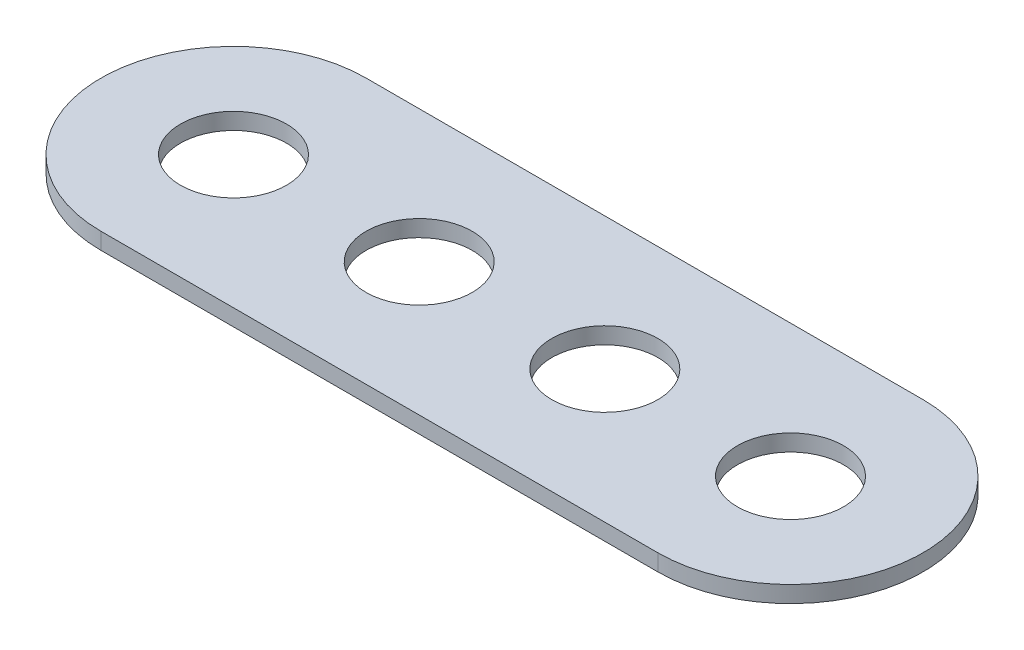
from build123d import *

# Parameters (mm, degrees)
BOSS_EXTRUDE1_DEPTH = 3.175
SKETCH3_R           = 10.16
CUT_EXTRUDE1_DEPTH  = 135.537604501
LPATTERN1_COUNT     = 4
LPATTERN1_PITCH     = 35.56


with BuildPart() as part:
    # Sketch1 → Boss-Extrude1 (new body)
    with BuildSketch(Plane(origin=(0, 0, 0), x_dir=(1, 0, 0), z_dir=(0, 1, 0))):
        with BuildLine():
            Line((0, 25.4), (-106.68, 25.4))
            ThreePointArc((-106.68, 25.4), (-132.08, 0), (-106.68, -25.4))
            Line((-106.68, -25.4), (0, -25.4))
            ThreePointArc((0, -25.4), (25.4, 0), (0, 25.4))
        make_face()
    extrude(amount=BOSS_EXTRUDE1_DEPTH)

    # Sketch3 → Cut-Extrude1 (cut, through all)
    with BuildSketch(Plane(origin=(0, 3.175, 0), x_dir=(1, 0, 0), z_dir=(0, 1, 0))):
        with Locations(Location((-106.68, 0, 0), (0, 0, 270))):
            Circle(SKETCH3_R)
    cut_extrude1 = extrude(amount=-CUT_EXTRUDE1_DEPTH, mode=Mode.SUBTRACT)

    # LPattern1: Cut-Extrude1 ×4
    with Locations(*[(i * LPATTERN1_PITCH, 0, 0) for i in range(1, LPATTERN1_COUNT)]):
        add(cut_extrude1, mode=Mode.SUBTRACT)


solid = part.part
